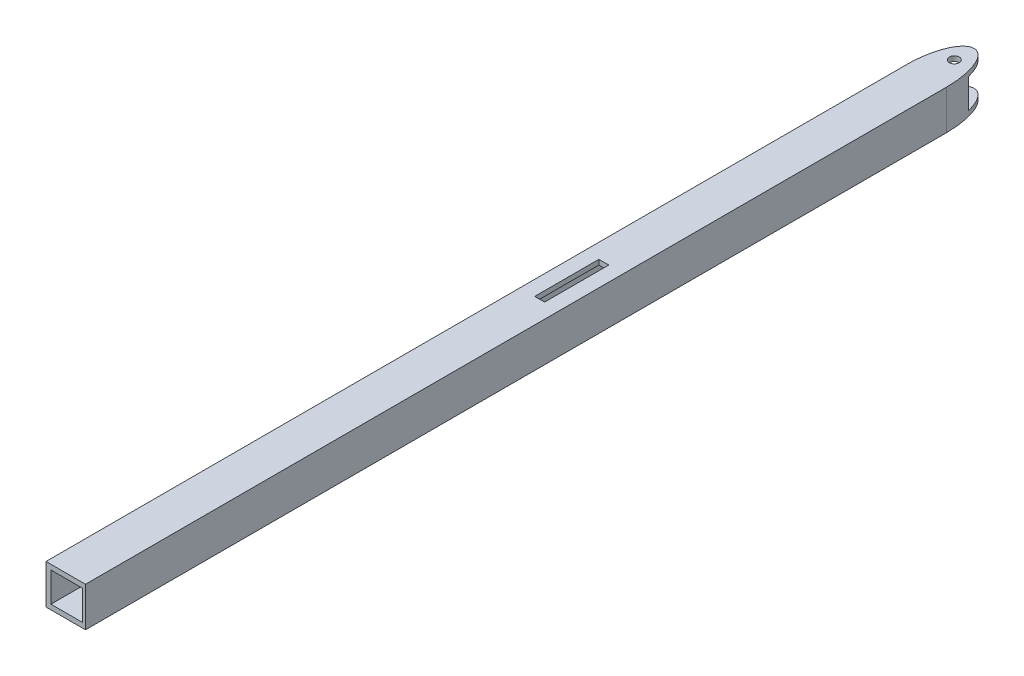
from build123d import *

# Parameters (mm, degrees)
SKETCH1_W           = 25.4
SKETCH1_H           = 25.4
BOSS_EXTRUDE2_DEPTH = 584.2
SKETCH2_W           = 20.302766191
SKETCH2_H           = 19.05
CUT_EXTRUDE1_DEPTH  = 586.303305988
CUT_EXTRUDE2_DEPTH  = 586.303305988
SKETCH6_R           = 3.175
CUT_EXTRUDE5_DEPTH  = 586.303306096
SKETCH4_W           = 6.35
SKETCH4_H           = 41.278824243
CUT_EXTRUDE6_DEPTH  = 586.303306096


with BuildPart() as part:
    # Sketch1 → Boss-Extrude2 (new body)
    with BuildSketch(Plane.XY):
        with Locations((12.7, 12.7)):
            Rectangle(SKETCH1_W, SKETCH1_H)
    extrude(amount=BOSS_EXTRUDE2_DEPTH)

    # Sketch2 → Cut-Extrude1 (cut, through all)
    with BuildSketch(Plane(origin=(0, 0, 0), x_dir=(-1, 0, 0), z_dir=(0, 0, -1))):
        with Locations((-13.326383096, 12.7)):
            Rectangle(SKETCH2_W, SKETCH2_H)
    extrude(amount=-CUT_EXTRUDE1_DEPTH, mode=Mode.SUBTRACT)

    # Sketch3 → Cut-Extrude2 (cut, through all)
    with BuildSketch(Plane(origin=(0, 25.4, 0), x_dir=(1, 0, 0), z_dir=(0, 1, 0))):
        with BuildLine():
            add(Edge.make_bspline(
                [(12.7, 0), (0, 0), (0, -30.465860076)],
                knots=[6.283185307, 6.283185307, 6.283185307, 7.853981634, 7.853981634, 7.853981634], degree=2, weights=[1, 0.707106781, 1]))
            Line((12.7, 0), (0, 0))
            Line((0, 0), (0, -30.465860076))
        make_face()
        with BuildLine():
            Line((25.4, 0), (12.7, 0))
            add(Edge.make_bspline(
                [(25.4, -30.465860076), (25.4, 0), (12.7, 0)],
                knots=[4.71238898, 4.71238898, 4.71238898, 6.283185307, 6.283185307, 6.283185307], degree=2, weights=[1, 0.707106781, 1]))
            Line((25.4, -30.465860076), (25.4, 0))
        make_face()
    extrude(amount=-CUT_EXTRUDE2_DEPTH, mode=Mode.SUBTRACT)

    # Sketch6 → Cut-Extrude5 (cut, through all)
    with BuildSketch(Plane(origin=(0, 25.4, 0), x_dir=(1, 0, 0), z_dir=(0, 1, 0))):
        with Locations(Location((12.7, -12.7, 0), (0, 0, 270))):
            Circle(SKETCH6_R)
    extrude(amount=-CUT_EXTRUDE5_DEPTH, mode=Mode.SUBTRACT)

    # Sketch4 → Cut-Extrude6 (cut, through all)
    with BuildSketch(Plane(origin=(0, 25.4, 0), x_dir=(1, 0, 0), z_dir=(0, 1, 0))):
        with Locations((12.7, -258.760587879)):
            Rectangle(SKETCH4_W, SKETCH4_H)
    extrude(amount=-CUT_EXTRUDE6_DEPTH, mode=Mode.SUBTRACT)


solid = part.part
